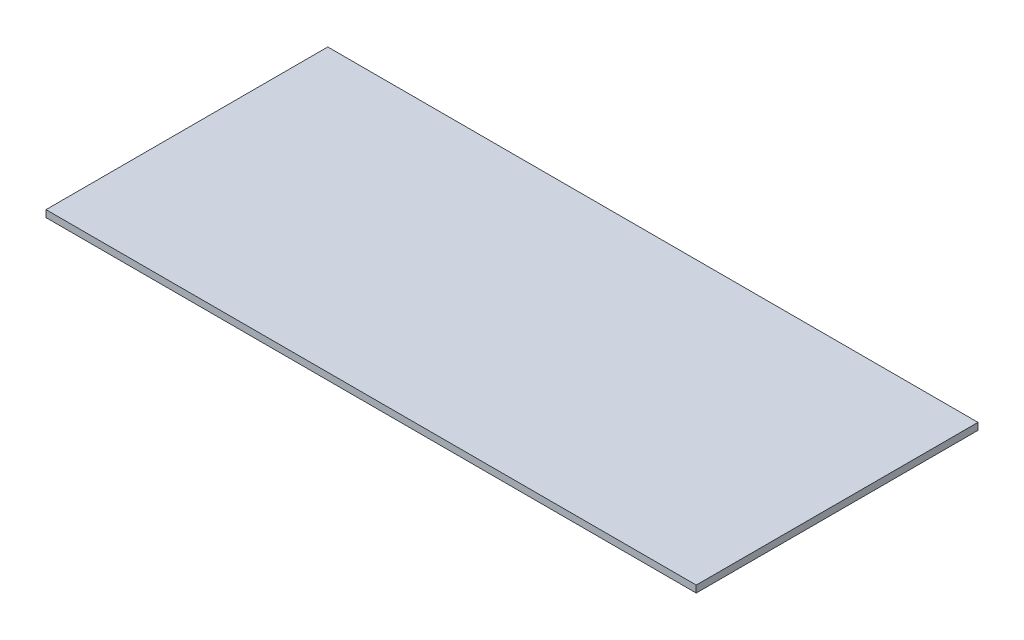
from build123d import *

# Parameters (mm, degrees)
SKETCH1_W           = 1500
SKETCH1_H           = 650
BOSS_EXTRUDE1_DEPTH = 16


with BuildPart() as part:
    # Sketch1 → Boss-Extrude1 (new body)
    with BuildSketch(Plane(origin=(0, 0, 0), x_dir=(1, 0, 0), z_dir=(0, 1, 0))):
        Rectangle(SKETCH1_W, SKETCH1_H)
    extrude(amount=BOSS_EXTRUDE1_DEPTH)


solid = part.part
